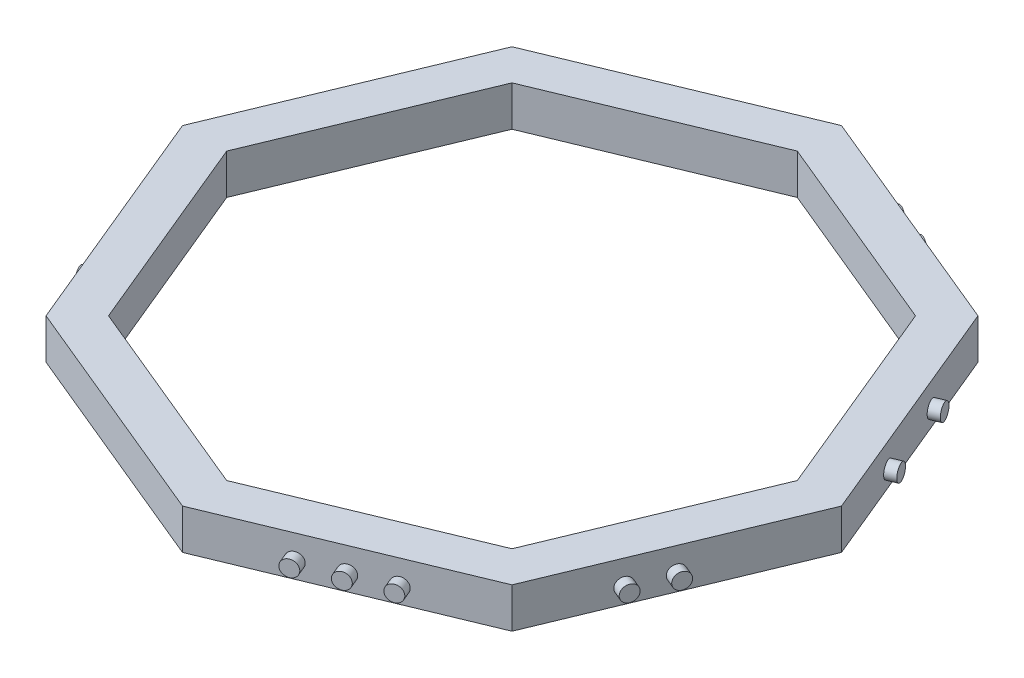
from build123d import *

# Parameters (mm, degrees)
BOSS_EXTRUDE1_DEPTH  = 5
CUT_EXTRUDE1_DEPTH   = 5
SKETCH6_R            = 1
BOSS_EXTRUDE5_DEPTH  = 1.25
SKETCH7_R            = 1
BOSS_EXTRUDE6_DEPTH  = 1.25
SKETCH8_R            = 1
BOSS_EXTRUDE7_DEPTH  = 1.25
BOSS_EXTRUDE8_START  = 1.25
SKETCH9_R            = 1
BOSS_EXTRUDE8_DEPTH  = 1.25
SKETCH10_R           = 1
BOSS_EXTRUDE9_DEPTH  = 1.25
BOSS_EXTRUDE10_START = 1.25
SKETCH11_R           = 1
BOSS_EXTRUDE10_DEPTH = 1.25
BOSS_EXTRUDE11_START = 1.25
SKETCH12_R           = 1
BOSS_EXTRUDE11_DEPTH = 1.25


with BuildPart() as part:
    # Sketch3 → Boss-Extrude1 (new body)
    with BuildSketch(Plane(origin=(0, 0, 0), x_dir=(1, 0, 0), z_dir=(0, 1, 0))):
        Polygon((41, 0), (28.991378029, 28.991378029), (0, 41), (-28.991378029, 28.991378029), (-41, 0), (-28.991378029, -28.991378029), (0, -41), (28.991378029, -28.991378029), align=None)
    extrude(amount=BOSS_EXTRUDE1_DEPTH)

    # Sketch5 → Cut-Extrude1 (cut)
    with BuildSketch(Plane(origin=(0, 5, 0), x_dir=(1, 0, 0), z_dir=(0, 1, 0))):
        Polygon((35.5, 0), (25.102290732, 25.102290732), (0, 35.5), (-25.102290732, 25.102290732), (-35.5, 0), (-25.102290732, -25.102290732), (0, -35.5), (25.102290732, -25.102290732), align=None)
    extrude(amount=-CUT_EXTRUDE1_DEPTH, mode=Mode.SUBTRACT)

    # Sketch6 → Boss-Extrude5 (add)
    with BuildSketch(Plane(origin=(14.495689014, 0, 34.995689014), x_dir=(0.9238795325112827, 0, -0.38268343236509966), z_dir=(0.38268343236509966, 0, 0.9238795325112827))):
        with Locations(Location((0, 2, 0), (0, 0, 180))):
            Circle(SKETCH6_R)
        with Locations(Location((-5, 2, 0), (0, 0, 180))):
            Circle(SKETCH6_R)
        with Locations(Location((5, 2, 0), (0, 0, 180))):
            Circle(SKETCH6_R)
    extrude(amount=BOSS_EXTRUDE5_DEPTH)

    # Sketch7 → Boss-Extrude6 (add)
    with BuildSketch(Plane(origin=(-34.995689014, 0, 14.495689014), x_dir=(0.3826834323650997, 0, 0.9238795325112827), z_dir=(-0.9238795325112827, 0, 0.3826834323650997))):
        with Locations(Location((5, 2, 0), (0, 0, 180))):
            Circle(SKETCH7_R)
    extrude(amount=BOSS_EXTRUDE6_DEPTH)

    # Sketch8 → Boss-Extrude7 (add)
    with BuildSketch(Plane(origin=(-34.995689014, 0, -14.495689014), x_dir=(-0.3826834323650795, 0, 0.9238795325112911), z_dir=(-0.9238795325112911, 0, -0.3826834323650795))):
        with Locations(Location((0, 2, 0), (0, 0, 180))):
            Circle(SKETCH8_R)
    extrude(amount=BOSS_EXTRUDE7_DEPTH)

    # Sketch9 → Boss-Extrude8 (add)
    with BuildSketch(Plane(origin=(-14.495689014, 0, -34.995689014), x_dir=(-0.9238795325112826, 0, 0.38268343236509983), z_dir=(-0.38268343236509983, 0, -0.9238795325112826)).offset(BOSS_EXTRUDE8_START)):
        with Locations((-5, 2)):
            Circle(SKETCH9_R)
    extrude(amount=-BOSS_EXTRUDE8_DEPTH)

    # Sketch10 → Boss-Extrude9 (add)
    with BuildSketch(Plane(origin=(14.495689014, 0, -34.995689014), x_dir=(-0.923879532511291, 0, -0.38268343236507973), z_dir=(0.38268343236507973, 0, -0.923879532511291))):
        with Locations(Location((0, 2, 0), (0, 0, 180))):
            Circle(SKETCH10_R)
        with Locations(Location((5, 2, 0), (0, 0, 180))):
            Circle(SKETCH10_R)
    extrude(amount=BOSS_EXTRUDE9_DEPTH)

    # Sketch11 → Boss-Extrude10 (add)
    with BuildSketch(Plane(origin=(34.995689014, 0, -14.495689014), x_dir=(-0.3826834323651001, 0, -0.9238795325112825), z_dir=(0.9238795325112824, 0, -0.38268343236510005)).offset(BOSS_EXTRUDE10_START)):
        with Locations(Location((5, 2, 0), (0, 0, 180))):
            Circle(SKETCH11_R)
        with Locations((-5, 2)):
            Circle(SKETCH11_R)
    extrude(amount=-BOSS_EXTRUDE10_DEPTH)

    # Sketch12 → Boss-Extrude11 (add)
    with BuildSketch(Plane(origin=(34.995689014, 0, 14.495689014), x_dir=(0.3826834323650795, 0, -0.923879532511291), z_dir=(0.9238795325112911, 0, 0.38268343236507957)).offset(BOSS_EXTRUDE11_START)):
        with Locations((0, 2)):
            Circle(SKETCH12_R)
        with Locations(Location((-5, 2, 0), (0, 0, 180))):
            Circle(SKETCH12_R)
    extrude(amount=-BOSS_EXTRUDE11_DEPTH)


solid = part.part
